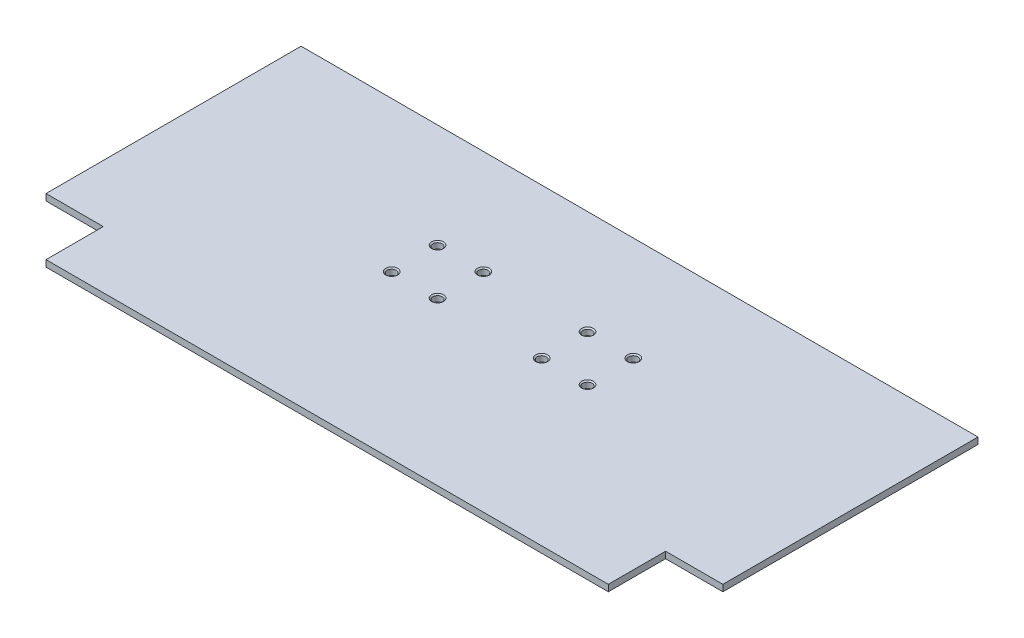
from build123d import *

# Parameters (mm, degrees)
BOSS_EXTRUDE1_DEPTH                   = 3.175
F_16_0_177_DIAMETER_HOLE1_D           = 4.4958
F_16_0_177_DIAMETER_HOLE1_DEPTH       = 3.175
F_16_0_177_DIAMETER_HOLE1_CSINK_D     = 5.7658
F_16_0_177_DIAMETER_HOLE1_CSINK_ANGLE = 100
F_16_0_177_DIAMETER_HOLE1_TIP         = 1.350674586


with BuildPart() as part:
    # Sketch1 → Boss-Extrude1 (new body)
    with BuildSketch(Plane(origin=(0, 0, 0), x_dir=(1, 0, 0), z_dir=(0, 1, 0))):
        Polygon((-137.16, -50.8), (137.16, -50.8), (137.16, -22.86), (165.1, -22.86), (165.1, 101.6), (-165.1, 101.6), (-165.1, -22.86), (-137.16, -22.86), align=None)
    extrude(amount=BOSS_EXTRUDE1_DEPTH)

    # #16 (0.177) Diameter Hole1
    with Locations(Plane(origin=(0, 3.175, 0), x_dir=(1, 0, 0), z_dir=(0, 1, 0))):
        with Locations((-47.752, 50.8), (-25.4, 50.8), (-25.4, 28.448), (-47.752, 28.448), (25.4, 28.448), (25.4, 50.8), (47.752, 50.8), (47.752, 28.448)):
            CounterSinkHole(F_16_0_177_DIAMETER_HOLE1_D / 2, F_16_0_177_DIAMETER_HOLE1_CSINK_D / 2, depth=F_16_0_177_DIAMETER_HOLE1_DEPTH, counter_sink_angle=F_16_0_177_DIAMETER_HOLE1_CSINK_ANGLE)
            with Locations((0, 0, -(F_16_0_177_DIAMETER_HOLE1_DEPTH + F_16_0_177_DIAMETER_HOLE1_TIP / 2))):  # 118° drill point
                Cone(0, F_16_0_177_DIAMETER_HOLE1_D / 2, F_16_0_177_DIAMETER_HOLE1_TIP, mode=Mode.SUBTRACT)


solid = part.part
